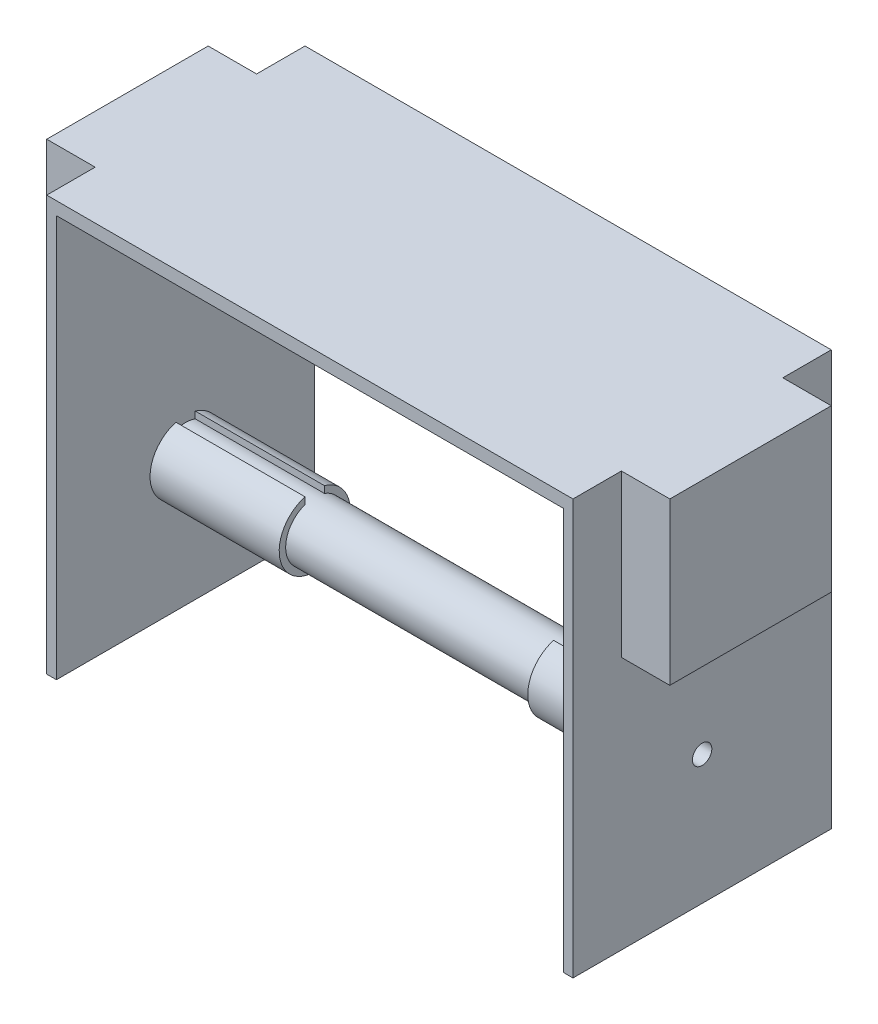
from build123d import *

# Parameters (mm, degrees)
SALIENTE_EXTRUIR1_START = 80
SALIENTE_EXTRUIR1_DEPTH = 3
SALIENTE_EXTRUIR2_START = 40
SALIENTE_EXTRUIR2_DEPTH = 40
SALIENTE_EXTRUIR3_START = -80
CROQUIS3_W              = 80
CROQUIS3_H              = 128.485281374
SALIENTE_EXTRUIR3_DEPTH = 3
SALIENTE_EXTRUIR4_DEPTH = 40
SALIENTE_EXTRUIR5_START = 84.5
CROQUIS5_W              = 163
CROQUIS5_H              = 80
SALIENTE_EXTRUIR5_DEPTH = 4
SALIENTE_EXTRUIR6_START = -3
SALIENTE_EXTRUIR6_DEPTH = 3
SALIENTE_EXTRUIR7_START = 88.5
CROQUIS7_W              = 15
CROQUIS7_H              = 50
SALIENTE_EXTRUIR7_DEPTH = 50
CROQUIS8_R              = 9
SALIENTE_EXTRUIR8_DEPTH = 157
CROQUIS10_R             = 3
CORTAR_EXTRUIR1_DEPTH   = 20
CORTAR_EXTRUIR2_START   = -20
CROQUIS11_R             = 3
CORTAR_EXTRUIR2_DEPTH   = 20


with BuildPart() as part:
    # Croquis1 → Saliente-Extruir1 (new body)
    with BuildSketch(Plane(origin=(0, 0, 0), x_dir=(0, 0, -1), z_dir=(1, 0, 0)).offset(SALIENTE_EXTRUIR1_START)):
        Polygon((-40, 8.485281374), (-40, -40), (40, -40), (40, 8.485281374), (40, 40), (40, 88.485281374), (-40, 88.485281374), (-40, 40), align=None)
        with BuildLine():
            Line((-3, 12), (0, 12))
            Line((0, 12), (3, 12))
            Line((3, 12), (3, 8.485281374))
            ThreePointArc((3, 8.485281374), (0, -9), (-3, 8.485281374))
            Line((-3, 8.485281374), (-3, 12))
        make_face(mode=Mode.SUBTRACT)
    extrude(amount=SALIENTE_EXTRUIR1_DEPTH)

    # Croquis2 → Saliente-Extruir2 (add)
    with BuildSketch(Plane.ZY.offset(-80).offset(SALIENTE_EXTRUIR2_START)):
        with BuildLine():
            Line((3, 8.485281374), (3, 10.583005244))
            ThreePointArc((3, 10.583005244), (0, -11), (-3, 10.583005244))
            Line((-3, 10.583005244), (-3, 8.485281374))
            ThreePointArc((-3, 8.485281374), (0, -9), (3, 8.485281374))
        make_face()
    extrude(amount=-SALIENTE_EXTRUIR2_DEPTH)



with BuildPart() as body_2:
    # Croquis3 → Saliente-Extruir3 (new body)
    with BuildSketch(Plane(origin=(0, 0, 0), x_dir=(0, 0, -1), z_dir=(1, 0, 0)).offset(SALIENTE_EXTRUIR3_START)):
        with Locations((0, 24.242640687)):
            Rectangle(CROQUIS3_W, CROQUIS3_H)
    extrude(amount=SALIENTE_EXTRUIR3_DEPTH)

    # Croquis4 → Saliente-Extruir4 (add)
    with BuildSketch(Plane(origin=(-77, 0, 0), x_dir=(0, 0, -1), z_dir=(1, 0, 0))):
        with BuildLine():
            Line((-3, 10.583005244), (-3, 8.485281374))
            ThreePointArc((-3, 8.485281374), (0, -9), (3, 8.485281374))
            Line((3, 8.485281374), (3, 10.583005244))
            ThreePointArc((3, 10.583005244), (0, -11), (-3, 10.583005244))
        make_face()
    extrude(amount=SALIENTE_EXTRUIR4_DEPTH)


with BuildPart() as part_1:
    add(part.part)

    add(body_2.part)  # Saliente-Extruir5 merges body 2
    # Croquis5 → Saliente-Extruir5 (add)
    with BuildSketch(Plane(origin=(0, 0, 0), x_dir=(1, 0, 0), z_dir=(0, 1, 0)).offset(SALIENTE_EXTRUIR5_START)):
        with Locations((1.5, 0)):
            Rectangle(CROQUIS5_W, CROQUIS5_H)
    extrude(amount=SALIENTE_EXTRUIR5_DEPTH)

    # Croquis6 → Saliente-Extruir6 (add)
    with BuildSketch(Plane(origin=(83, 0, 0), x_dir=(0, 0, -1), z_dir=(1, 0, 0)).offset(SALIENTE_EXTRUIR6_START)):
        with BuildLine():
            Line((3, 12), (3, 8.485281374))
            ThreePointArc((3, 8.485281374), (0, -9), (-3, 8.485281374))
            Line((-3, 8.485281374), (-3, 12))
            Line((-3, 12), (3, 12))
        make_face()
    extrude(amount=SALIENTE_EXTRUIR6_DEPTH)

    # Croquis7 → Saliente-Extruir7 (add)
    with BuildSketch(Plane(origin=(0, 0, 0), x_dir=(1, 0, 0), z_dir=(0, 1, 0)).offset(SALIENTE_EXTRUIR7_START)):
        with Locations((-87.5, 0)):
            Rectangle(CROQUIS7_W, CROQUIS7_H)
        with Locations((90.5, 0)):
            Rectangle(CROQUIS7_W, CROQUIS7_H)
    extrude(amount=-SALIENTE_EXTRUIR7_DEPTH)

    # Croquis8 → Saliente-Extruir8 (add)
    with BuildSketch(Plane(origin=(-77, 0, 0), x_dir=(0, 0, -1), z_dir=(1, 0, 0))):
        with Locations(Location((0, 0, 0), (0, 0, 109.471220634))):
            Circle(CROQUIS8_R)
    extrude(amount=SALIENTE_EXTRUIR8_DEPTH)

    # Croquis10 → Cortar-Extruir1 (cut)
    with BuildSketch(Plane.ZY.offset(80)):
        Circle(CROQUIS10_R)
    extrude(amount=-CORTAR_EXTRUIR1_DEPTH, mode=Mode.SUBTRACT)

    # Croquis11 → Cortar-Extruir2 (cut)
    with BuildSketch(Plane(origin=(83, 0, 0), x_dir=(0, 0, -1), z_dir=(1, 0, 0)).offset(CORTAR_EXTRUIR2_START)):
        with Locations(Location((0, 0, 0), (0, 0, 180))):
            Circle(CROQUIS11_R)
    extrude(amount=CORTAR_EXTRUIR2_DEPTH, mode=Mode.SUBTRACT)


solid = part_1.part
